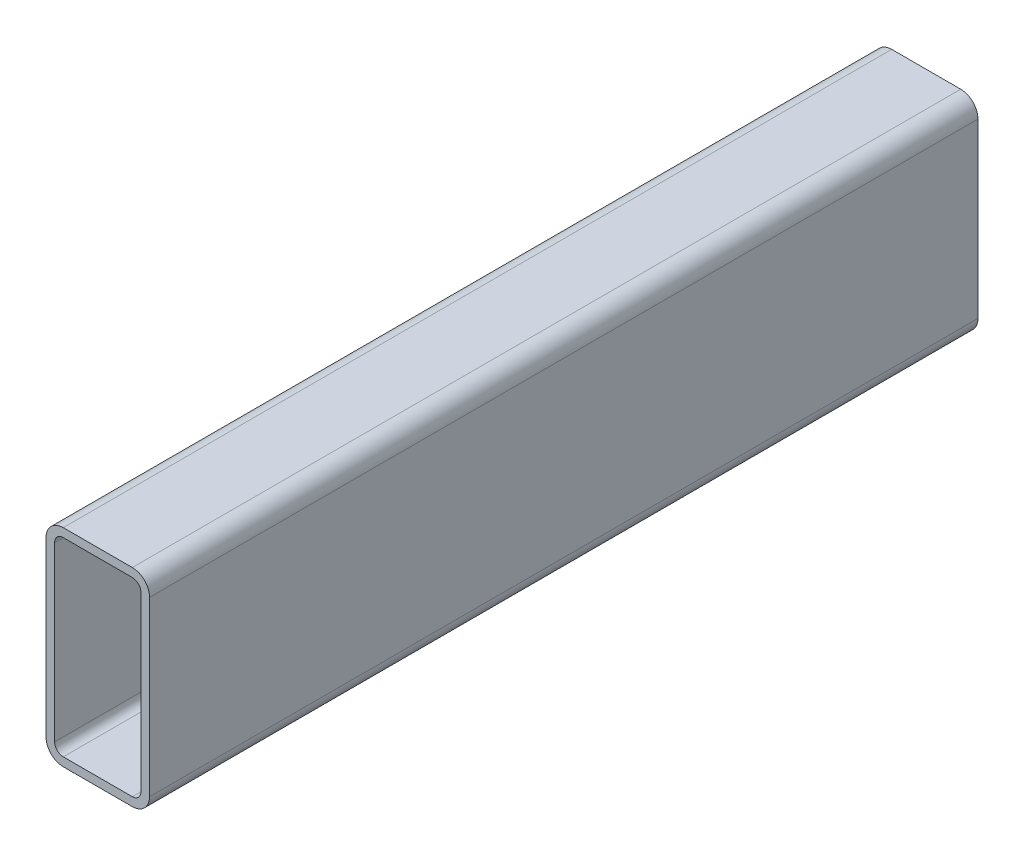
from build123d import *

# Parameters (mm, degrees)
BOSS_EXTRUDE1_DEPTH = 609.6


with BuildPart() as part:
    # Sketch1 → Boss-Extrude1 (new body)
    with BuildSketch(Plane.XY):
        with BuildLine():
            Line((-25.4, -76.2), (25.4, -76.2))
            ThreePointArc((25.4, -76.2), (34.380256121, -72.480256121), (38.1, -63.5))
            Line((38.1, -63.5), (38.1, 63.5))
            ThreePointArc((38.1, 63.5), (34.380256121, 72.480256121), (25.4, 76.2))
            Line((25.4, 76.2), (-25.4, 76.2))
            ThreePointArc((-25.4, 76.2), (-34.380256121, 72.480256121), (-38.1, 63.5))
            Line((-38.1, 63.5), (-38.1, -63.5))
            ThreePointArc((-38.1, -63.5), (-34.380256121, -72.480256121), (-25.4, -76.2))
        make_face()
        with BuildLine():
            Line((-25.4, -69.85), (25.4, -69.85))
            ThreePointArc((25.4, -69.85), (29.890128061, -67.990128061), (31.75, -63.5))
            Line((31.75, -63.5), (31.75, 63.5))
            ThreePointArc((31.75, 63.5), (29.890128061, 67.990128061), (25.4, 69.85))
            Line((25.4, 69.85), (-25.4, 69.85))
            ThreePointArc((-25.4, 69.85), (-29.890128061, 67.990128061), (-31.75, 63.5))
            Line((-31.75, 63.5), (-31.75, -63.5))
            ThreePointArc((-31.75, -63.5), (-29.890128061, -67.990128061), (-25.4, -69.85))
        make_face(mode=Mode.SUBTRACT)
    extrude(amount=BOSS_EXTRUDE1_DEPTH)


solid = part.part
